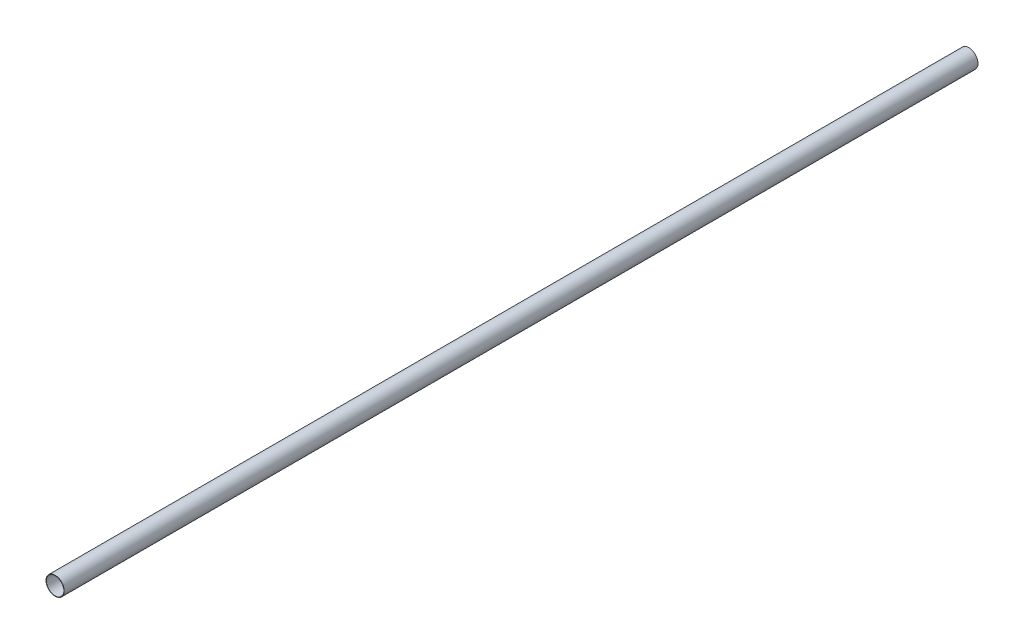
from build123d import *

# Parameters (mm, degrees)
SKETCH1_R           = 15
SKETCH1_R_2         = 14.35
BOSS_EXTRUDE1_DEPTH = 1500


with BuildPart() as part:
    # Sketch1 → Boss-Extrude1 (new body)
    with BuildSketch(Plane.XY):
        Circle(SKETCH1_R)
        Circle(SKETCH1_R_2, mode=Mode.SUBTRACT)
    extrude(amount=BOSS_EXTRUDE1_DEPTH)


solid = part.part
